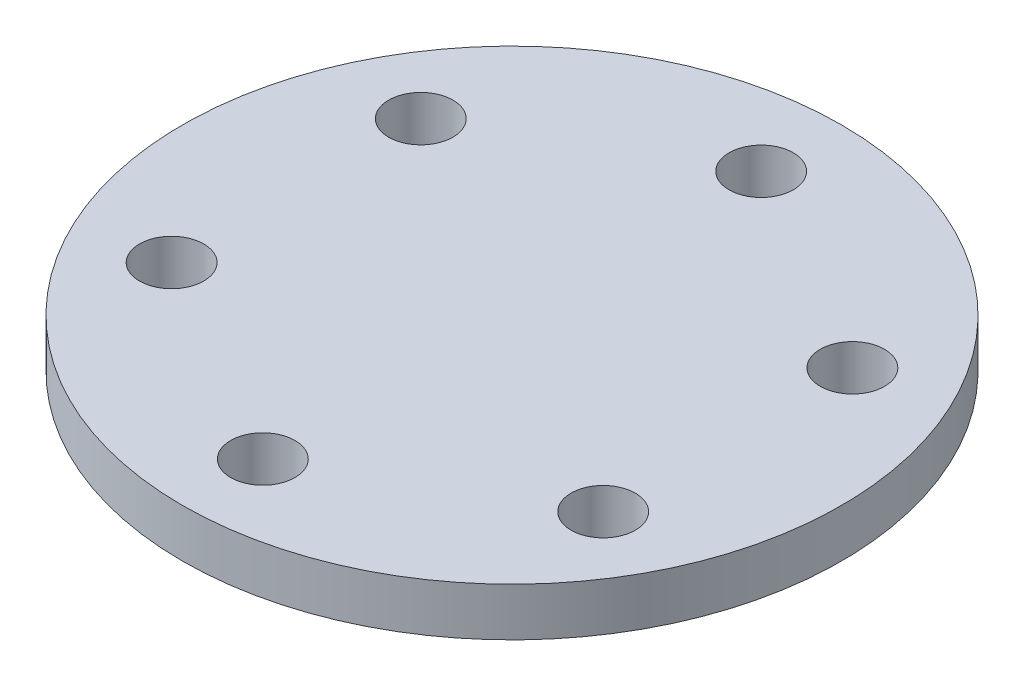
from build123d import *

# Parameters (mm, degrees)
SKETCH_1_R               = 20.5
EXTRUDE_1_DEPTH          = 3
CUT_EXTRUDE_1_REACH      = 31.146
SKETCH_2_R               = 2
PATTERN_CIRCULAR_1_COUNT = 6


with BuildPart() as part:
    # 草圖1 → 填料-伸長1 (new body)
    with BuildSketch(Plane(origin=(0, 0, 0), x_dir=(1, 0, 0), z_dir=(0, 1, 0))):
        with Locations(Location((0, 0, 0), (0, 0, 270))):
            Circle(SKETCH_1_R)
    extrude(amount=EXTRUDE_1_DEPTH)

    # 草圖2 → 除料-伸長1 (cut, up to next)
    with BuildSketch(Plane(origin=(0, 3, 0), x_dir=(1, 0, 0), z_dir=(0, 1, 0)), mode=Mode.PRIVATE) as cut_extrude_1_sk1:
        with Locations(Location((0, 15.5, 0), (0, 0, 270))):
            Circle(SKETCH_2_R)
    cut_extrude_1_tool1 = extrude(cut_extrude_1_sk1.sketch, amount=-CUT_EXTRUDE_1_REACH, mode=Mode.PRIVATE) & part.part
    cut_extrude_1 = cut_extrude_1_tool1.solids().sort_by_distance((0, 3, -15.5))[0]
    add(cut_extrude_1, mode=Mode.SUBTRACT)

    # 環狀複製排列1: 除料-伸長1 ×6 about axis
    pattern_circular_1_axis = Axis((0, 0, 0), (0, 1, 0))
    for i in range(1, PATTERN_CIRCULAR_1_COUNT):
        add(cut_extrude_1.rotate(pattern_circular_1_axis, i * 360 / PATTERN_CIRCULAR_1_COUNT), mode=Mode.SUBTRACT)


solid = part.part
